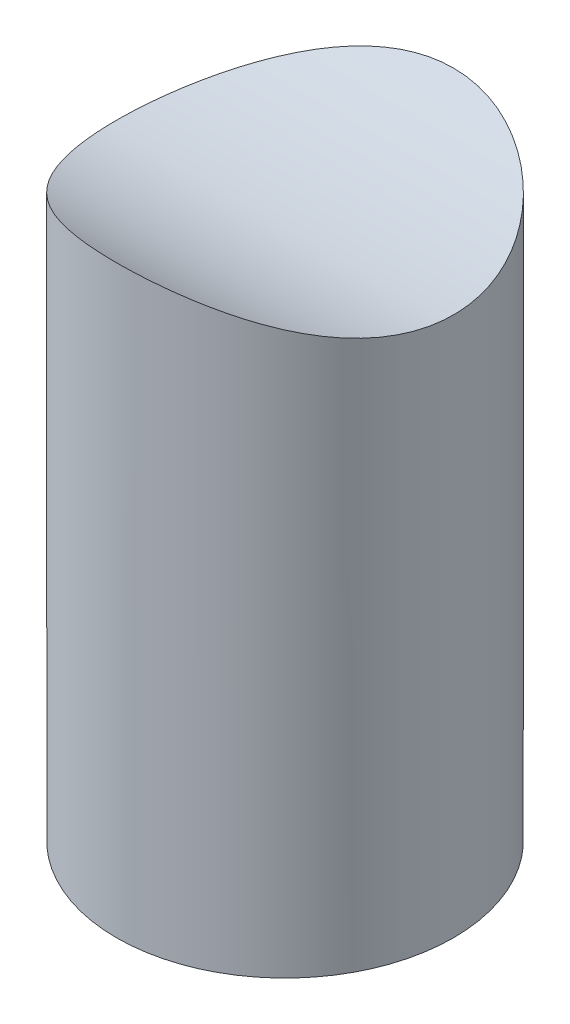
from build123d import *

# Parameters (mm, degrees)
CROQUIS2_R                 = 25
SALIENTE_EXTRUIR2_DEPTH    = 50
CORTAR_EXTRUIR1_DEPTH      = 62.23724357
CORTAR_EXTRUIR1_DEPTH_BACK = 62.23724357
CROQUIS3_R                 = 50


with BuildPart() as part:
    # Croquis2 → Saliente-Extruir2 (new, symmetric)
    with BuildSketch(Plane(origin=(0, 0, 0), x_dir=(1, 0, 0), z_dir=(0, 1, 0))):
        with Locations(Location((0, 0, 0), (0, 0, 270))):
            Circle(CROQUIS2_R)
    extrude(amount=SALIENTE_EXTRUIR2_DEPTH, both=True)

    # Croquis3 → Cortar-Extruir1 (cut, two sides: drawn at the far end of the back side and taken through both)
    with BuildSketch(Plane(origin=(0, 0, 0), x_dir=(0, 0, -1), z_dir=(1, 0, 0)).offset(-CORTAR_EXTRUIR1_DEPTH_BACK)):
        with Locations((0, 80)):
            Circle(CROQUIS3_R)
    extrude(amount=CORTAR_EXTRUIR1_DEPTH + CORTAR_EXTRUIR1_DEPTH_BACK, mode=Mode.SUBTRACT)


solid = part.part
